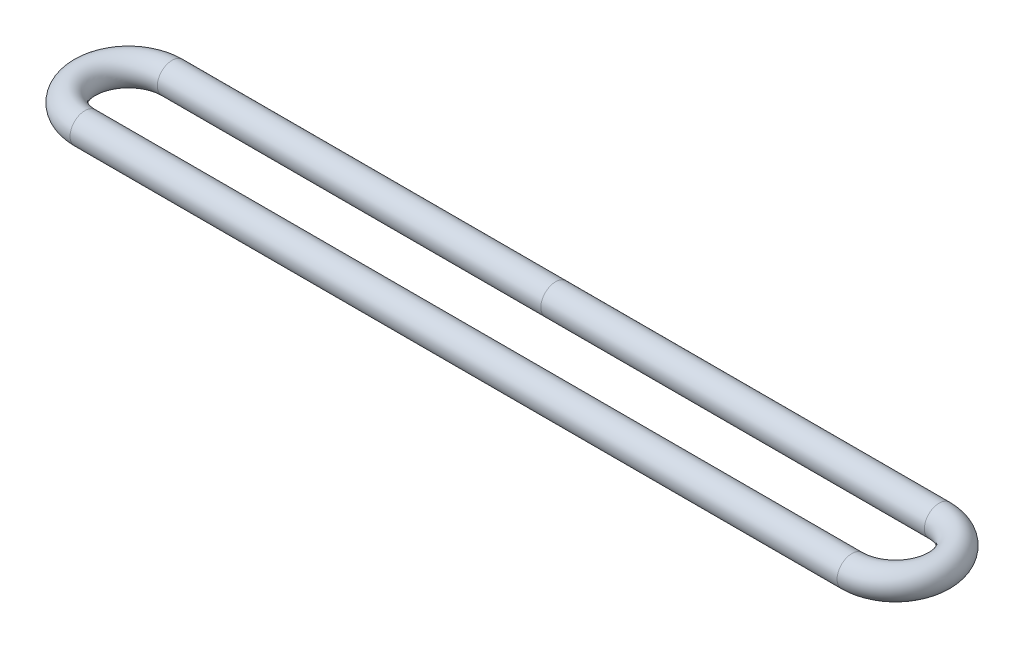
from build123d import *

# Parameters (mm, degrees)
SKETCH8_R = 2.38125


with BuildPart() as part:
    # Sweep2: sweep along a path in Sketch7
    with BuildLine(Plane(origin=(0, 0, 0), x_dir=(1, 0, 0), z_dir=(0, 1, 0))) as sweep2_path:
        Line((-61.722156815, -9.28146197), (61.722156815, -9.28146197))
        ThreePointArc((61.722156815, -9.28146197), (66.3628878, -4.640730985), (61.722156815, 0))
        Line((61.722156815, 0), (-61.722156815, 0))
        ThreePointArc((-61.722156815, 0), (-66.3628878, -4.640730985), (-61.722156815, -9.28146197))
    # Sketch8 → Sweep2 (sweep)
    with BuildSketch(Plane(origin=(0, 0, 0), x_dir=(0, 0, -1), z_dir=(1, 0, 0))):
        with Locations((2.38125, 0)):
            Circle(SKETCH8_R)
    sweep(path=sweep2_path.line)


solid = part.part
